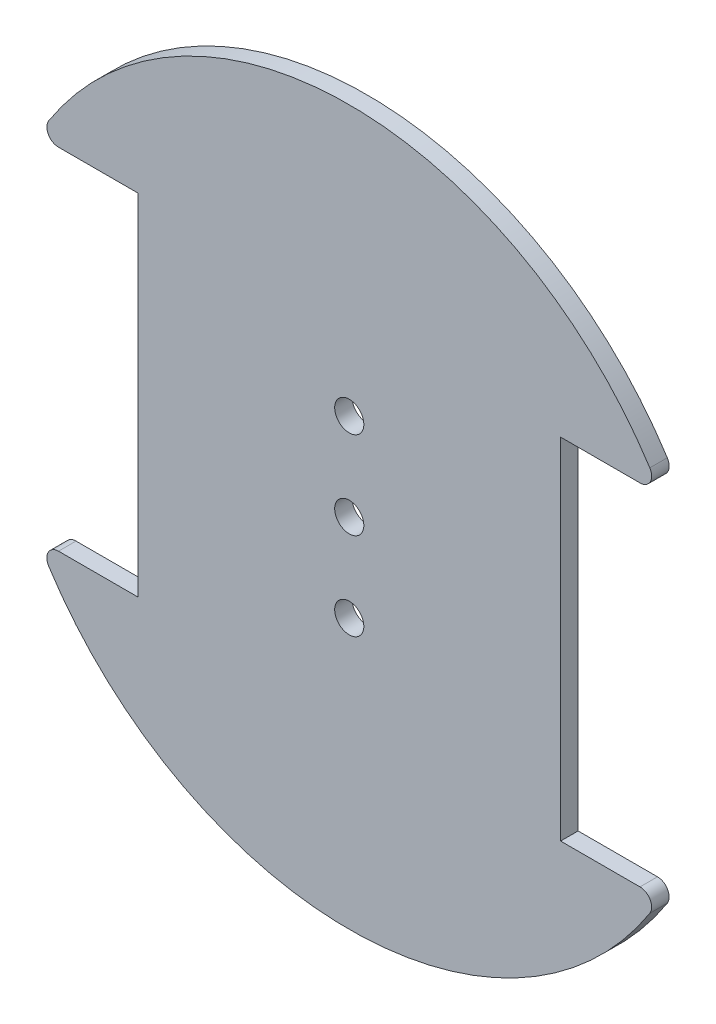
from build123d import *

# Parameters (mm, degrees)
ESBO_O1_R                = 5
RESSALTO_EXTRUS_O1_DEPTH = 6


with BuildPart() as part:
    # Esboço1 → Ressalto-extrusão1 (new body)
    with BuildSketch(Plane.XY):
        with BuildLine():
            Line((-72.5, 60), (-99.730887893, 60))
            ThreePointArc((-99.730887893, 60), (-103.240969816, 62.08184336), (-103.097331367, 66.160337553))
            ThreePointArc((-103.097331367, 66.160337553), (0, 122.5), (103.097331367, 66.160337553))
            ThreePointArc((103.097331367, 66.160337553), (103.240969816, 62.08184336), (99.730887893, 60))
            Line((99.730887893, 60), (72.5, 60))
            Line((72.5, 60), (72.5, -60))
            Line((72.5, -60), (99.730887893, -60))
            ThreePointArc((99.730887893, -60), (103.240969816, -62.08184336), (103.097331367, -66.160337553))
            ThreePointArc((103.097331367, -66.160337553), (0, -122.5), (-103.097331367, -66.160337553))
            ThreePointArc((-103.097331367, -66.160337553), (-103.240969816, -62.08184336), (-99.730887893, -60))
            Line((-99.730887893, -60), (-72.5, -60))
            Line((-72.5, -60), (-72.5, 60))
        make_face()
        with Locations((0, -30)):
            Circle(ESBO_O1_R, mode=Mode.SUBTRACT)
        Circle(ESBO_O1_R, mode=Mode.SUBTRACT)
        with Locations((0, 30)):
            Circle(ESBO_O1_R, mode=Mode.SUBTRACT)
    extrude(amount=RESSALTO_EXTRUS_O1_DEPTH)


solid = part.part
